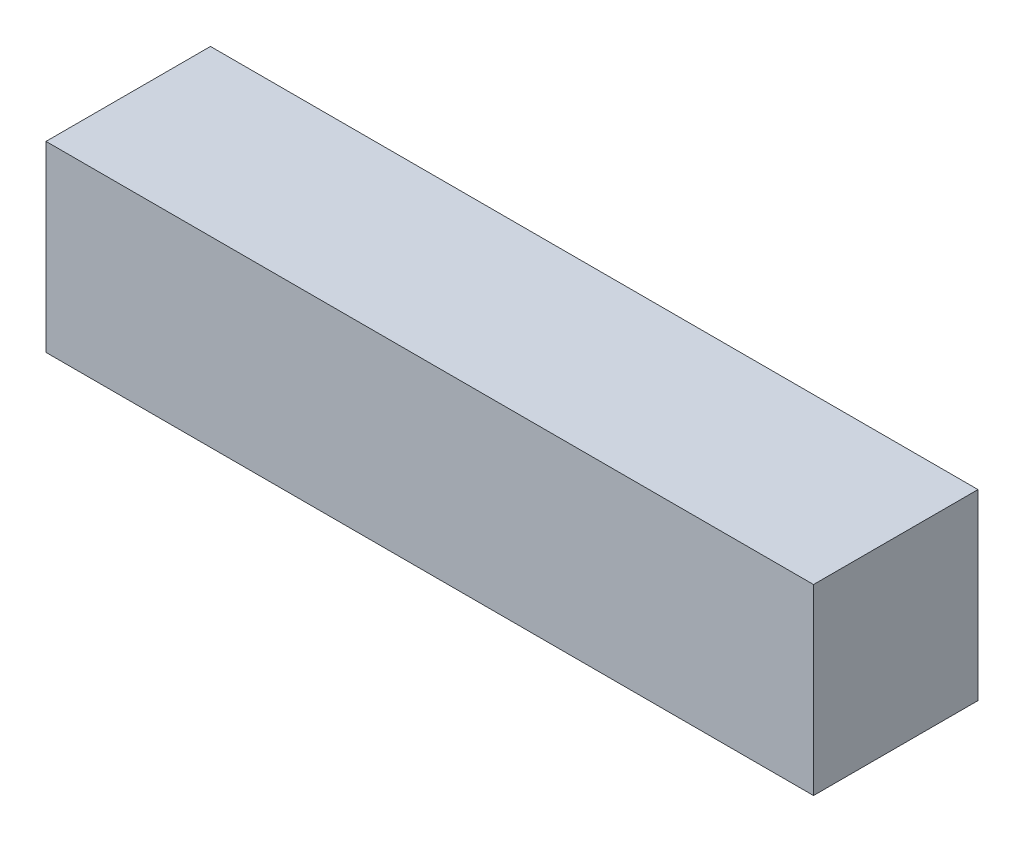
from build123d import *

# Parameters (mm, degrees)
SKETCH_1_W        = 700
SKETCH_1_H        = 166.7
EXTRUDE_304_DEPTH = 150


with BuildPart() as part:
    # 草图1 → Extrude 304 (new body)
    with BuildSketch(Plane.XY):
        with Locations((350, 83.35)):
            Rectangle(SKETCH_1_W, SKETCH_1_H)
    extrude(amount=EXTRUDE_304_DEPTH)


solid = part.part
